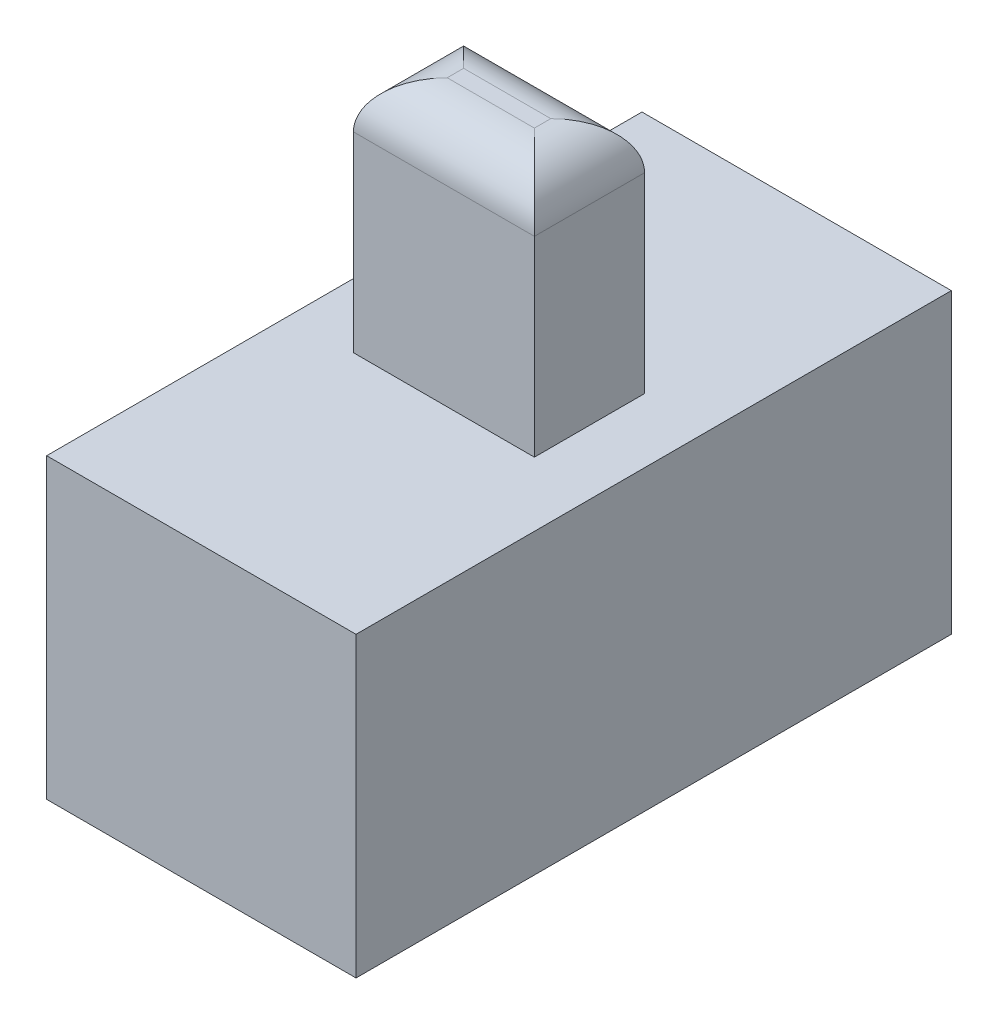
from build123d import *

# Parameters (mm, degrees)
SKETCH1_W           = 6.6
SKETCH1_H           = 12.7
BOSS_EXTRUDE1_DEPTH = 6.35
SKETCH2_W           = 3.86
SKETCH2_H           = 2.35
BOSS_EXTRUDE2_DEPTH = 5.08
FILLET1_R           = 1


with BuildPart() as part:
    # Sketch1 → Boss-Extrude1 (new body)
    with BuildSketch(Plane(origin=(0, 0, 0), x_dir=(1, 0, 0), z_dir=(0, 1, 0))):
        Rectangle(SKETCH1_W, SKETCH1_H)
    extrude(amount=BOSS_EXTRUDE1_DEPTH)

    # Sketch2 → Boss-Extrude2 (add)
    with BuildSketch(Plane(origin=(0, 6.35, 0), x_dir=(1, 0, 0), z_dir=(0, 1, 0))):
        Rectangle(SKETCH2_W, SKETCH2_H)
    extrude(amount=BOSS_EXTRUDE2_DEPTH)

    # Fillet1
    fillet1_edges = [part.edges().sort_by_distance(p)[0] for p in [
        (1.93, 11.43, 0),
        (0, 11.43, -1.175),
        (-1.93, 11.43, 0),
        (0, 11.43, 1.175),
    ]]
    fillet(fillet1_edges, radius=FILLET1_R)


solid = part.part
